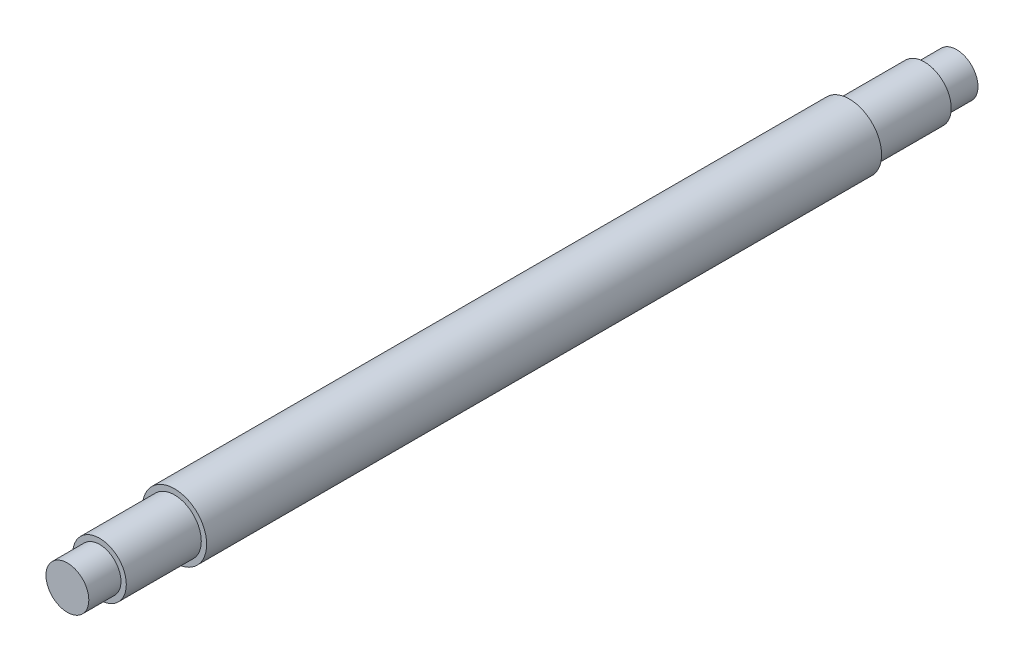
from build123d import *


with BuildPart() as part:
    # Sketch1 → Revolve1 (revolve)
    with BuildSketch(Plane(origin=(0, 0, 0), x_dir=(0, 0, -1), z_dir=(1, 0, 0)), mode=Mode.PRIVATE) as revolve1_sk:
        Polygon((0, 0), (0, 2), (3, 2), (3, 2.5), (10, 2.5), (10, 3), (73, 3), (73, 2.5), (80, 2.5), (80, 2), (83, 2), (83, 0), align=None)
    revolve(revolve1_sk.sketch.rotate(Axis((0, 0, 10.073341037), (0, 0, -1)), 90), axis=Axis((0, 0, 10.073341037), (0, 0, -1)))


solid = part.part
